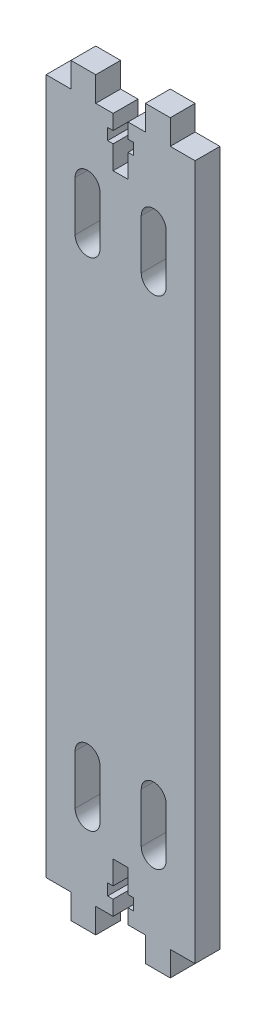
from build123d import *

# Parameters (mm, degrees)
BOSS_EXTRUDE1_DEPTH = 5


with BuildPart() as part:
    # Sketch1 → Boss-Extrude1 (new body)
    with BuildSketch(Plane.XY):
        Polygon((-10, 70), (-15, 70), (-15, -70), (-10, -70), (-10, -75), (-5, -75), (-5, -70), (-1.5, -70), (-1.5, -67), (-2.6, -67), (-2.6, -64.7), (-1.5, -64.7), (-1.5, -60), (1.5, -60), (1.5, -64.7), (2.6, -64.7), (2.6, -67), (1.5, -67), (1.5, -70), (5, -70), (5, -75), (10, -75), (10, -70), (15, -70), (15, 70), (10, 70), (10, 75), (5, 75), (5, 70), (1.5, 70), (1.5, 67), (2.6, 67), (2.6, 64.7), (1.5, 64.7), (1.5, 60), (-1.5, 60), (-1.5, 64.7), (-2.6, 64.7), (-2.6, 67), (-1.5, 67), (-1.5, 70), (-5, 70), (-5, 75), (-10, 75), align=None)
        with BuildLine():
            ThreePointArc((-4.156470727, -55), (-6.656470727, -57.5), (-9.156470727, -55))
            Line((-9.156470727, -55), (-9.156470727, -45))
            ThreePointArc((-9.156470727, -45), (-6.656470727, -42.5), (-4.156470727, -45))
            Line((-4.156470727, -45), (-4.156470727, -55))
        make_face(mode=Mode.SUBTRACT)
        with BuildLine():
            Line((9.156470727, -45), (9.156470727, -55))
            ThreePointArc((9.156470727, -55), (6.656470727, -57.5), (4.156470727, -55))
            Line((4.156470727, -55), (4.156470727, -45))
            ThreePointArc((4.156470727, -45), (6.656470727, -42.5), (9.156470727, -45))
        make_face(mode=Mode.SUBTRACT)
        with BuildLine():
            Line((-9.156470727, 45), (-9.156470727, 55))
            ThreePointArc((-9.156470727, 55), (-6.656470727, 57.5), (-4.156470727, 55))
            Line((-4.156470727, 55), (-4.156470727, 45))
            ThreePointArc((-4.156470727, 45), (-6.656470727, 42.5), (-9.156470727, 45))
        make_face(mode=Mode.SUBTRACT)
        with BuildLine():
            ThreePointArc((4.156470727, 55), (6.656470727, 57.5), (9.156470727, 55))
            Line((9.156470727, 55), (9.156470727, 45))
            ThreePointArc((9.156470727, 45), (6.656470727, 42.5), (4.156470727, 45))
            Line((4.156470727, 45), (4.156470727, 55))
        make_face(mode=Mode.SUBTRACT)
    extrude(amount=BOSS_EXTRUDE1_DEPTH)


solid = part.part
